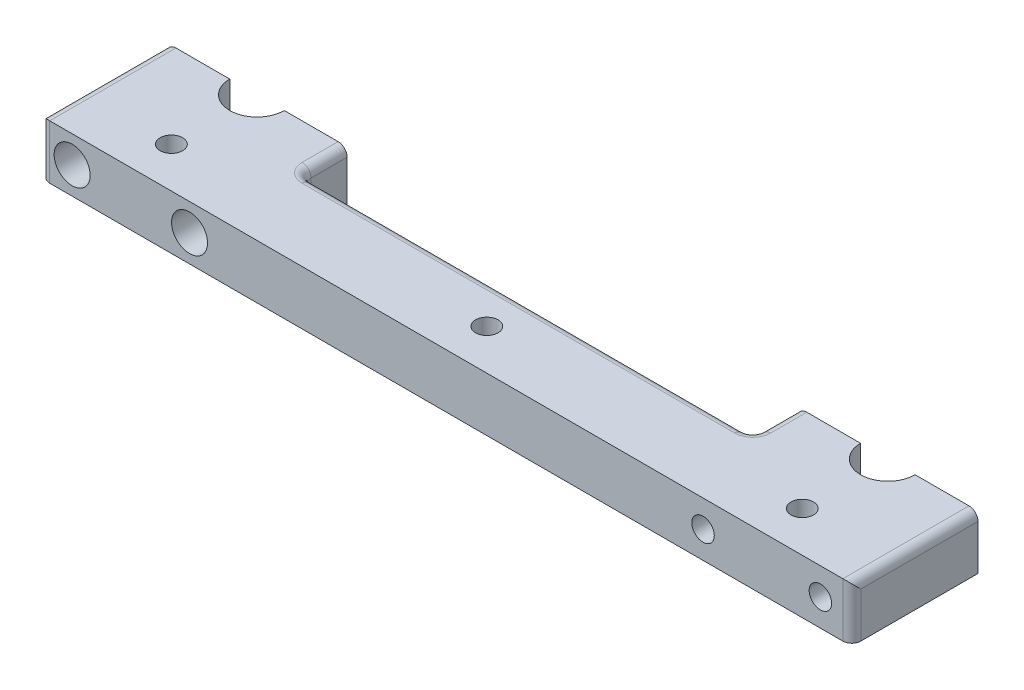
from build123d import *

# Parameters (mm, degrees)
ESQUISSE1_W             = 180
ESQUISSE1_H             = 18
BOSS_EXTRU_1_DEPTH      = 12
ESQUISSE3_W             = 40
ESQUISSE3_H             = 12
BOSS_EXTRU_2_DEPTH      = 10
ESQUISSE4_R             = 6.05
ENL_V_MAT_EXTRU_1_DEPTH = 12
ENL_V_START             = -28
ESQUISSE5_R             = 2.5
ENL_V_MAT_EXTRU_2_DEPTH = 28
ESQUISSE6_R             = 4
ENL_V_MAT_EXTRU_3_DEPTH = 12
ESQUISSE9_R             = 2.5
ENL_V_MAT_EXTRU_4_DEPTH = 12
CONG_1_R                = 2


with BuildPart() as part:
    # Esquisse1 → Boss.-Extru.1 (new body)
    with BuildSketch(Plane(origin=(0, 0, 0), x_dir=(1, 0, 0), z_dir=(0, 1, 0))):
        with Locations((4.022267576, 28.402118524)):
            Rectangle(ESQUISSE1_W, ESQUISSE1_H)
    extrude(amount=BOSS_EXTRU_1_DEPTH)

    # Esquisse3 → Boss.-Extru.2 (add)
    with BuildSketch(Plane(origin=(0, 0, -37.402118524), x_dir=(-1, 0, 0), z_dir=(0, 0, -1))):
        with Locations((65.977732424, 6)):
            Rectangle(ESQUISSE3_W, ESQUISSE3_H)
    boss_extru_2 = extrude(amount=BOSS_EXTRU_2_DEPTH)

    # Esquisse4 → Enlèv. mat.-Extru.1 (cut)
    with BuildSketch(Plane(origin=(0, 12, 0), x_dir=(1, 0, 0), z_dir=(0, 1, 0))):
        with Locations((-65.977732424, 47.402118524)):
            Circle(ESQUISSE4_R)
    enl_v_mat_extru_1 = extrude(amount=-ENL_V_MAT_EXTRU_1_DEPTH, mode=Mode.SUBTRACT)

    # Esquisse5 → Enlèv. mat.-Extru.2 (cut)
    with BuildSketch(Plane(origin=(0, 0, -47.402118524), x_dir=(-1, 0, 0), z_dir=(0, 0, -1)).offset(ENL_V_START)):
        with Locations((52.952732424, 6)):
            Circle(ESQUISSE5_R)
        with Locations((79.002732424, 6)):
            Circle(ESQUISSE5_R)
    enl_v_mat_extru_2 = extrude(amount=ENL_V_MAT_EXTRU_2_DEPTH, mode=Mode.SUBTRACT)

    # Esquisse6 → Enlèv. mat.-Extru.3 (cut)
    with BuildSketch(Plane.XY.offset(-19.402118524)):
        with Locations((-52.952732424, 6)):
            Circle(ESQUISSE6_R)
        with Locations((-79.002732424, 6)):
            Circle(ESQUISSE6_R)
    extrude(amount=-ENL_V_MAT_EXTRU_3_DEPTH, mode=Mode.SUBTRACT)

    # Symétrie4: Boss.-Extru.2, Enlèv. mat.-Extru.1, Enlèv. mat.-Extru.2 across plane
    add(boss_extru_2.mirror(Plane(origin=(4.022267576, 12, -19.402118524), x_dir=(0, 0, 1), z_dir=(-1, 0, 0))))
    add(enl_v_mat_extru_1.mirror(Plane(origin=(4.022267576, 12, -19.402118524), x_dir=(0, 0, 1), z_dir=(-1, 0, 0))), mode=Mode.SUBTRACT)
    add(enl_v_mat_extru_2.mirror(Plane(origin=(4.022267576, 12, -19.402118524), x_dir=(0, 0, 1), z_dir=(-1, 0, 0))), mode=Mode.SUBTRACT)

    # Esquisse9 → Enlèv. mat.-Extru.4 (cut)
    with BuildSketch(Plane(origin=(0, 12, 0), x_dir=(1, 0, 0), z_dir=(0, 1, 0))):
        with Locations(Location((4.022267576, 28.402118524, 0), (0, 0, 270))):
            Circle(ESQUISSE9_R)
        with Locations(Location((74.022267576, 28.402118524, 0), (0, 0, 270))):
            Circle(ESQUISSE9_R)
        with Locations(Location((-65.977732424, 28.402118524, 0), (0, 0, 270))):
            Circle(ESQUISSE9_R)
    extrude(amount=-ENL_V_MAT_EXTRU_4_DEPTH, mode=Mode.SUBTRACT)

    # Congé1
    cong_1_edges = [part.edges().sort_by_distance(p)[0] for p in [
        (94.022267576, 12, -33.402118524),
        (-45.977732424, 6, -37.402118524),
        (-45.977732424, 12, -42.402118524),
        (-85.977732424, 12, -33.402118524),
        (4.022267576, 12, -37.402118524),
        (54.022267576, 12, -42.402118524),
        (54.022267576, 6, -37.402118524),
        (94.022267576, 6, -19.402118524),
        (-85.977732424, 6, -19.402118524),
    ]]
    fillet(cong_1_edges, radius=CONG_1_R)


solid = part.part
